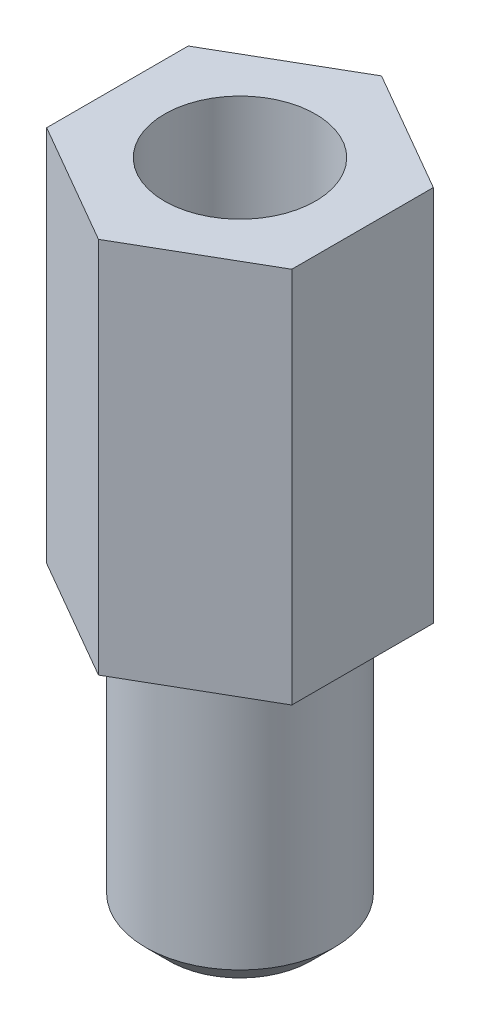
from build123d import *

# Parameters (mm, degrees)
EXTRUDE_1_DEPTH       = 4
SKETCH_4_R            = 1
EXTRUDE_2_DEPTH       = 3
CHAMFER_1_SIZE        = 0.25
HOLE_WIZARD_M23_D     = 1.6
HOLE_WIZARD_M23_DEPTH = 4
HOLE_WIZARD_M23_TIP   = 0.480688495


with BuildPart() as part:
    # Эскиз1 → Бобышка-Вытянуть1 (new body)
    with BuildSketch(Plane(origin=(0, 0, 0), x_dir=(1, 0, 0), z_dir=(0, 1, 0))):
        Polygon((0, 1.5), (-1.299038106, 0.75), (-1.299038106, -0.75), (0, -1.5), (1.299038106, -0.75), (1.299038106, 0.75), align=None)
    extrude(amount=EXTRUDE_1_DEPTH)

    # Эскиз4 → Бобышка-Вытянуть2 (add)
    with BuildSketch(Plane.XZ):
        with Locations(Location((0, 0, 0), (0, 0, 270))):
            Circle(SKETCH_4_R)
    extrude(amount=EXTRUDE_2_DEPTH)

    # Фаска1
    chamfer_1_edges = [part.edges().sort_by_distance(p)[0] for p in [
        (0, -3, 1),
    ]]
    chamfer(chamfer_1_edges, length=CHAMFER_1_SIZE)

    # Отверстие обработанное метчиком M23
    with Locations(Plane(origin=(0, 4, 0), x_dir=(1, 0, 0), z_dir=(0, 1, 0))):
        with Locations((0, 0)):
            Hole(HOLE_WIZARD_M23_D / 2, depth=HOLE_WIZARD_M23_DEPTH)
            with Locations((0, 0, -(HOLE_WIZARD_M23_DEPTH + HOLE_WIZARD_M23_TIP / 2))):  # 118° drill point
                Cone(0, HOLE_WIZARD_M23_D / 2, HOLE_WIZARD_M23_TIP, mode=Mode.SUBTRACT)


solid = part.part
